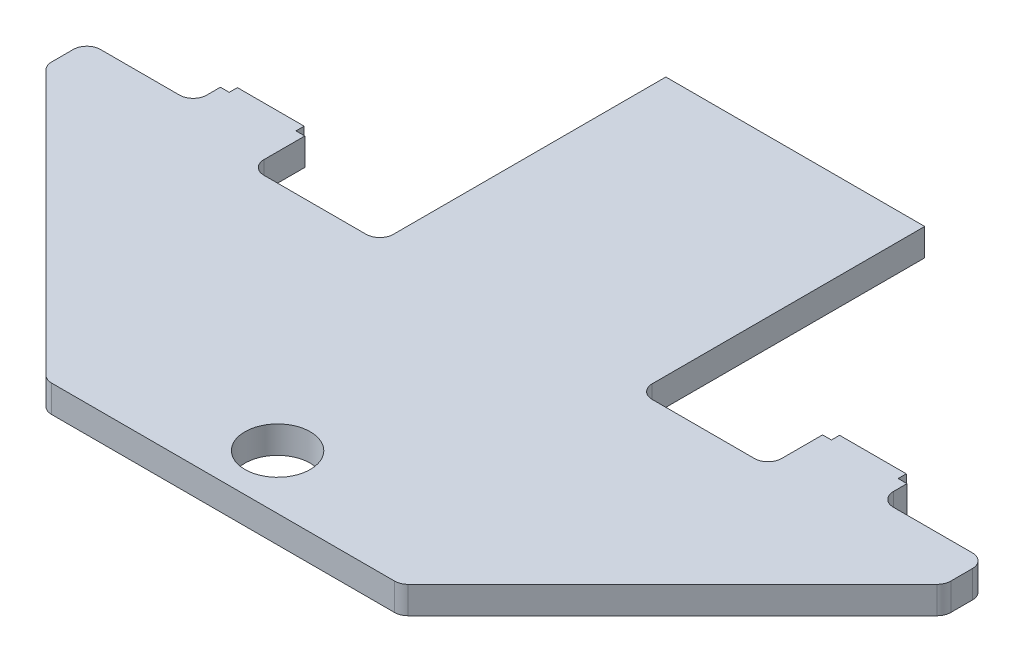
from build123d import *

# Parameters (mm, degrees)
SKETCH1_R               = 12
EXTRUDE1_DEPTH          = 10
FILLET1_R               = 5
ESQUISSE1_W             = 95
ESQUISSE1_H             = 80
ENL_V_MAT_EXTRU_1_DEPTH = 220.886334273


with BuildPart() as part:
    # Sketch1 → Extrude1 (new body)
    with BuildSketch(Plane(origin=(0, 0, 0), x_dir=(1, 0, 0), z_dir=(0, 1, 0))):
        Polygon((-165, -30), (-165, -45), (-65, -145), (65, -145), (165, -45), (165, -30), (126, -30), (126, -20), (122.75, -20), (122.75, -17), (98.25, -17), (98.25, -20), (95, -20), (95, -40), (47.5, -40), (47.5, 123.333333333), (15, 145), (-15, 145), (-47.5, 123.333333333), (-47.5, -40), (-95, -40), (-95, -20), (-98.25, -20), (-98.25, -17), (-122.75, -17), (-122.75, -20), (-126, -20), (-126, -30), align=None)
        with Locations(Location((0, 113, 0), (0, 0, 270))):
            Circle(SKETCH1_R, mode=Mode.SUBTRACT)
        with Locations(Location((0, -125, 0), (0, 0, 270))):
            Circle(SKETCH1_R, mode=Mode.SUBTRACT)
    extrude(amount=EXTRUDE1_DEPTH)

    # Fillet1
    fillet1_edges = [part.edges().sort_by_distance(p)[0] for p in [
        (-126, 5, 30),
        (-95, 5, 40),
        (-47.5, 5, 40),
        (-47.5, 5, -123.333333333),
        (-15, 5, -145),
        (15, 5, -145),
        (47.5, 5, -123.333333333),
        (47.5, 5, 40),
        (95, 5, 40),
        (126, 5, 30),
        (165, 5, 30),
        (165, 5, 45),
        (65, 5, 145),
        (-65, 5, 145),
        (-165, 5, 45),
        (-165, 5, 30),
    ]]
    fillet(fillet1_edges, radius=FILLET1_R)

    # Esquisse1 → Enlèv. mat.-Extru.1 (cut, through all)
    with BuildSketch(Plane(origin=(0, 10, 0), x_dir=(1, 0, 0), z_dir=(0, 1, 0))):
        with Locations((0, 105)):
            Rectangle(ESQUISSE1_W, ESQUISSE1_H)
    extrude(amount=-ENL_V_MAT_EXTRU_1_DEPTH, mode=Mode.SUBTRACT)


solid = part.part
